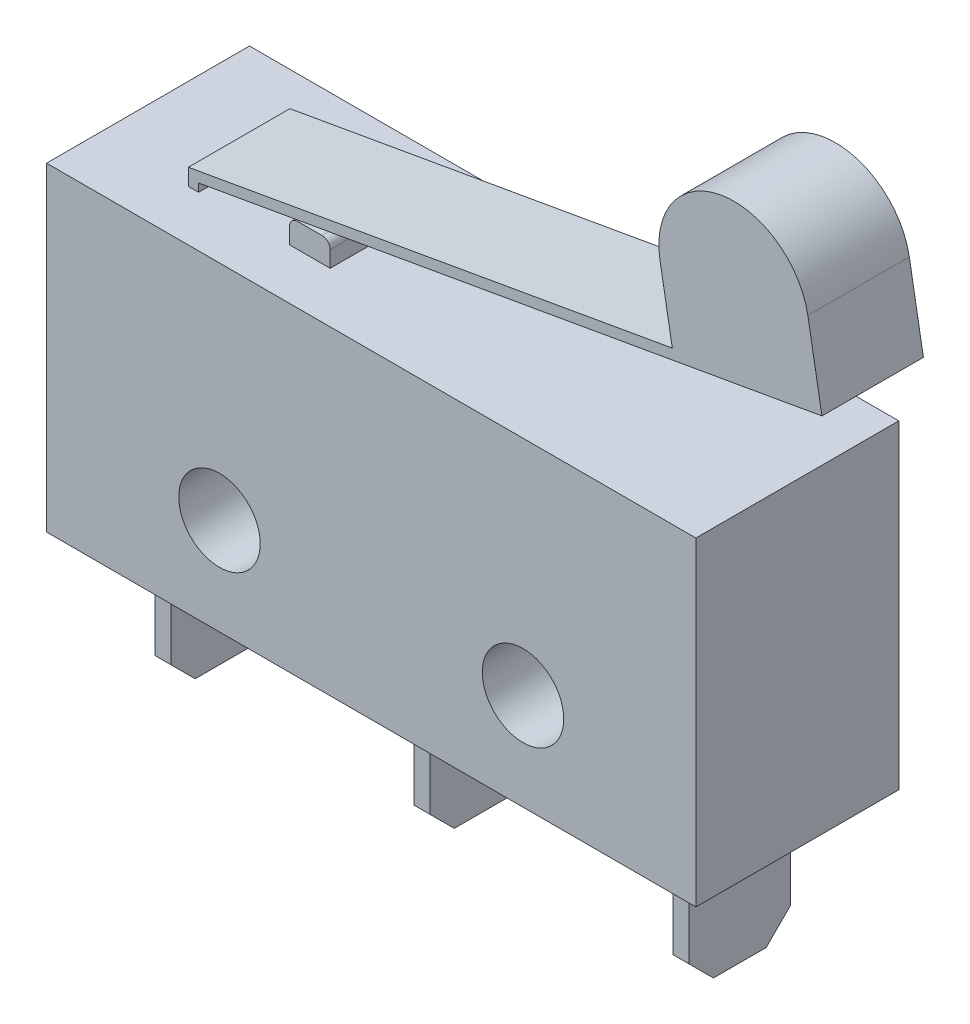
from build123d import *

# Parameters (mm, degrees)
SKETCH1_W           = 20.32
SKETCH1_H           = 6.35
BOSS_EXTRUDE1_DEPTH = 10
SKETCH2_W           = 0.5
SKETCH2_H           = 4
BOSS_EXTRUDE2_DEPTH = 1.5875
CHAMFER1_SIZE       = 0.762
SKETCH3_R           = 1.275
CUT_EXTRUDE1_DEPTH  = 23.934585372


with BuildPart() as part:
    # Sketch1 → Boss-Extrude1 (new body)
    with BuildSketch(Plane(origin=(0, 0, 0), x_dir=(1, 0, 0), z_dir=(0, 1, 0))):
        Rectangle(SKETCH1_W, SKETCH1_H)
    extrude(amount=BOSS_EXTRUDE1_DEPTH)

    # Sketch2 → Boss-Extrude2 (add, symmetric)
    with BuildSketch(Plane.XY):
        with BuildLine():
            Line((-4.1425, 10), (-4.1425, 10.508))
            ThreePointArc((-4.1425, 10.508), (-4.068105122, 10.687605122), (-3.8885, 10.762))
            Line((-3.8885, 10.762), (-3.1265, 10.762))
            ThreePointArc((-3.1265, 10.762), (-2.946894878, 10.687605122), (-2.8725, 10.508))
            Line((-2.8725, 10.508), (-2.8725, 10))
            Line((-2.8725, 10), (-4.1425, 10))
        make_face()
        with BuildLine():
            Line((-7.31, 10), (-7.31, 10.520414133))
            Line((-7.31, 10.520414133), (7.835766275, 13.191021371))
            Line((7.835766275, 13.191021371), (7.4498332, 15.379756602))
            ThreePointArc((7.4498332, 15.379756602), (9.355652622, 18.101548811), (12.077444831, 16.195729389))
            Line((12.077444831, 16.195729389), (12.518511203, 13.694317696))
            Line((12.518511203, 13.694317696), (-6.9925, 10.254))
            Line((-6.9925, 10.254), (-6.9925, 10))
            Line((-6.9925, 10), (-7.31, 10))
        make_face()
        with Locations((-8.11, -2)):
            Rectangle(SKETCH2_W, SKETCH2_H)
        with Locations((0, -2)):
            Rectangle(SKETCH2_W, SKETCH2_H)
        with Locations((8.11, -2)):
            Rectangle(SKETCH2_W, SKETCH2_H)
    extrude(amount=BOSS_EXTRUDE2_DEPTH, both=True)

    # Chamfer1
    chamfer1_edges = [part.edges().sort_by_distance(p)[0] for p in [
        (-8.11, -4, -1.5875),
        (-8.11, -4, 1.5875),
        (0, -4, -1.5875),
        (0, -4, 1.5875),
        (8.11, -4, -1.5875),
        (8.11, -4, 1.5875),
    ]]
    chamfer(chamfer1_edges, length=CHAMFER1_SIZE)

    # Sketch3 → Cut-Extrude1 (cut, through all)
    with BuildSketch(Plane.XY.offset(3.175)):
        with Locations((-4.75, 3.025)):
            Circle(SKETCH3_R)
        with Locations((4.75, 3.025)):
            Circle(SKETCH3_R)
    extrude(amount=-CUT_EXTRUDE1_DEPTH, mode=Mode.SUBTRACT)


solid = part.part
